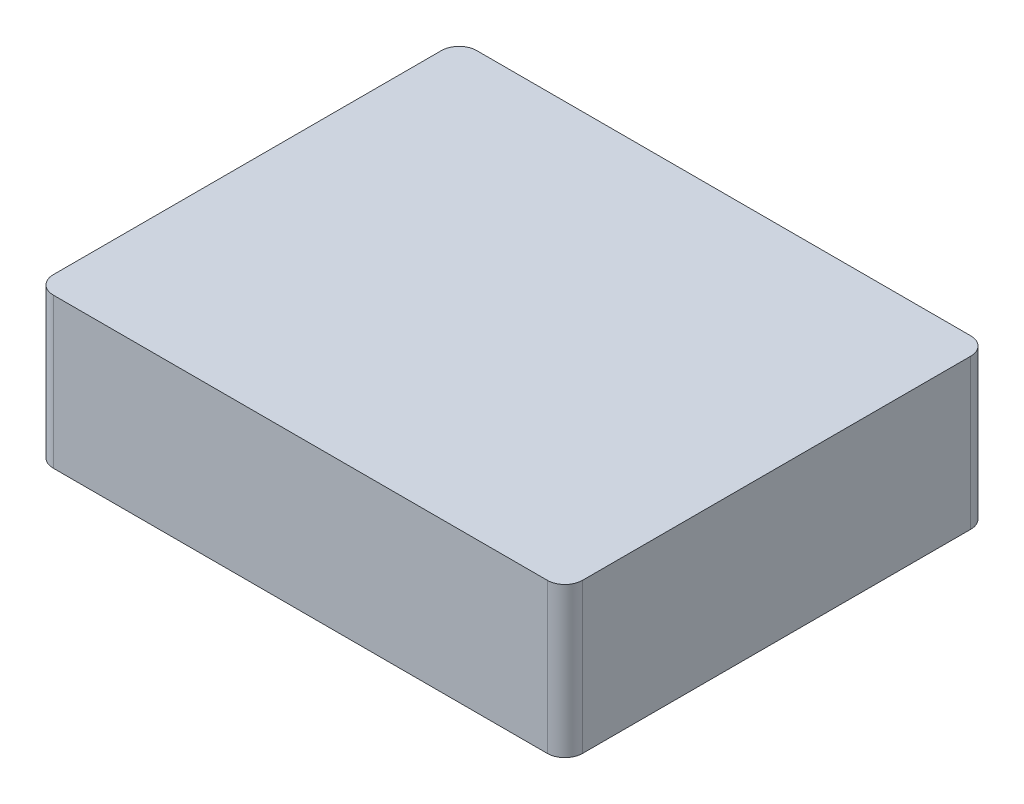
from build123d import *

# Parameters (mm, degrees)
SKETCH1_W           = 30
SKETCH1_H           = 8.5
BOSS_EXTRUDE1_DEPTH = 24
FILLET1_R           = 1


with BuildPart() as part:
    # Sketch1 → Boss-Extrude1 (new body)
    with BuildSketch(Plane.XY):
        with Locations((7.706624606, 0.174290221)):
            Rectangle(SKETCH1_W, SKETCH1_H)
    extrude(amount=BOSS_EXTRUDE1_DEPTH)

    # Fillet1
    fillet1_edges = [part.edges().sort_by_distance(p)[0] for p in [
        (22.706624606, 0.174290221, 24),
        (-7.293375394, 0.174290221, 24),
        (22.706624606, 0.174290221, 0),
        (-7.293375394, 0.174290221, 0),
    ]]
    fillet(fillet1_edges, radius=FILLET1_R)


solid = part.part
